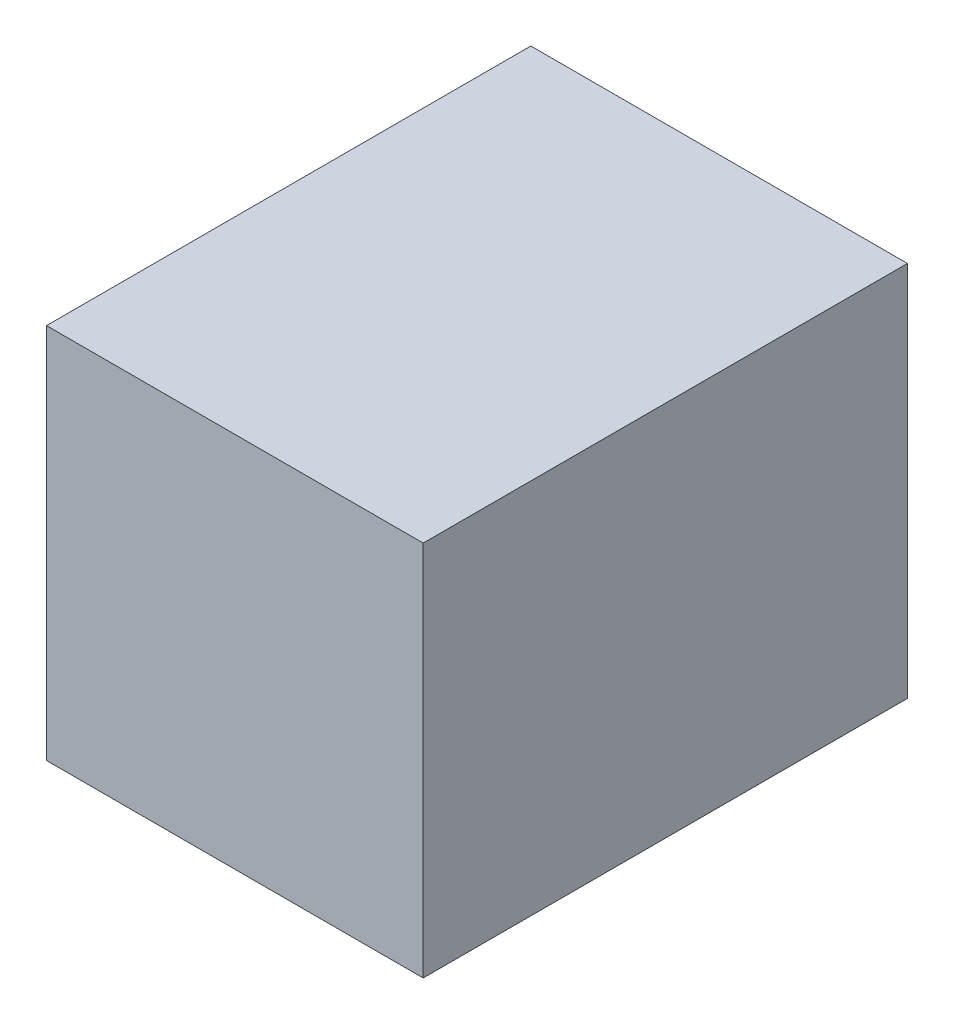
from build123d import *

# Parameters (mm, degrees)
ESQUISSE1_W        = 350
ESQUISSE1_H        = 350
BOSS_EXTRU_1_DEPTH = 450


with BuildPart() as part:
    # Esquisse1 → Boss.-Extru.1 (new body)
    with BuildSketch(Plane.XY):
        with Locations((175, 175)):
            Rectangle(ESQUISSE1_W, ESQUISSE1_H)
    extrude(amount=BOSS_EXTRU_1_DEPTH)


solid = part.part
